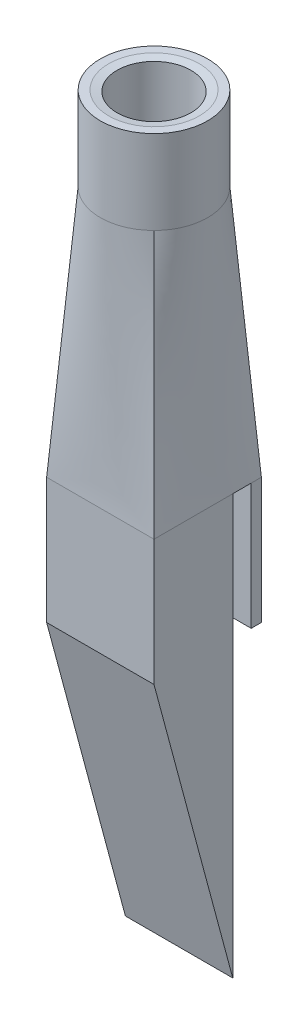
from build123d import *

# Parameters (mm, degrees)
SKETCH1_R                       = 6.4
SKETCH1_R_2                     = 4.4
BOSS_EXTRUDE1_DEPTH             = 10
CHAMFER1_SIZE                   = 1
CHAMFER1_SIZE2                  = 0.176326981
BOSS_EXTRUDE2_START             = -30
SKETCH4_W                       = 12.8
SKETCH4_H                       = 9.39
SKETCH4_H_2                     = 1.21
BOSS_EXTRUDE2_DEPTH             = 15
BOSS_EXTRUDE3_REACH             = 47.901
BOSS_EXTRUDE3_DIRECTION_2_REACH = 47.901


with BuildPart() as part:
    # Sketch1 → Boss-Extrude1 (new body)
    with BuildSketch(Plane(origin=(0, 0, 0), x_dir=(1, 0, 0), z_dir=(0, 1, 0))):
        with Locations(Location((0, 0, 0), (0, 0, 270))):
            Circle(SKETCH1_R)
        with Locations(Location((0, 0, 0), (0, 0, 270))):
            Circle(SKETCH1_R_2, mode=Mode.SUBTRACT)
    extrude(amount=BOSS_EXTRUDE1_DEPTH)

    # Chamfer1
    chamfer1_edges = [part.edges().sort_by_distance(p)[0] for p in [
        (0, 10, -4.4),
    ]]
    chamfer1_side = [part.faces().sort_by_distance(p)[0] for p in [
        (0, 10, -6.218980664),
    ]]
    chamfer(chamfer1_edges, length=CHAMFER1_SIZE, length2=CHAMFER1_SIZE2, reference=chamfer1_side[0])

    # Sketch2 for Loft1 → Loft1 section 0
    with BuildSketch(Plane.XZ):
        with BuildLine():
            # circular arc as an exact rational Bezier (weights 1, cos(half-angle), 1)
            Bezier((-4.5254834, -4.5254834), (0, -9.050966798), (4.5254834, -4.5254834), weights=[1, 0.707106781, 1])
            Bezier((4.5254834, -4.5254834), (9.050966798, 0), (4.5254834, 4.5254834), weights=[1, 0.707106781, 1])
            Bezier((4.5254834, 4.5254834), (0, 9.050966798), (-4.5254834, 4.5254834), weights=[1, 0.707106781, 1])
            Bezier((-4.5254834, 4.5254834), (-9.050966798, 0), (-4.5254834, -4.5254834), weights=[1, 0.707106781, 1])
        make_face()
    # Sketch3 → Loft1 section 1
    with BuildSketch(Plane(origin=(0, -30, 0), x_dir=(-1, 0, 0), z_dir=(0, -1, 0))):
        with BuildLine():
            Line((6.4, 6.4), (-6.4, 6.4))
            Line((-6.4, 6.4), (-6.4, -6.4))
            Line((-6.4, -6.4), (6.4, -6.4))
            Line((6.4, -6.4), (6.4, 6.4))
        make_face()
    loft()

    # Sketch4 → Boss-Extrude2 (add)
    with BuildSketch(Plane(origin=(0, 0, 0), x_dir=(1, 0, 0), z_dir=(0, 1, 0)).offset(BOSS_EXTRUDE2_START)):
        with Locations((0, -1.705)):
            Rectangle(SKETCH4_W, SKETCH4_H)
        with Locations((0, 5.795)):
            Rectangle(SKETCH4_W, SKETCH4_H_2)
    extrude(amount=-BOSS_EXTRUDE2_DEPTH)

    # Boss-Extrude3: up to this face of the body (flat: up to its plane)
    boss_extrude3_end = Plane(part.part.faces().sort_by_distance((6.4, -37.5, 1.705))[0])
    # Sketch5 → Boss-Extrude3 (add, up to the picked face)
    with BuildSketch(Plane(origin=(0, 0, 0), x_dir=(0, 0, -1), z_dir=(1, 0, 0)), mode=Mode.PRIVATE) as boss_extrude3_sk1:
        Polygon((2.99, -45), (2.99, -80), (-6.4, -45), align=None)
    boss_extrude3_tool1 = split(extrude(boss_extrude3_sk1.sketch, amount=BOSS_EXTRUDE3_REACH, mode=Mode.PRIVATE), bisect_by=boss_extrude3_end, keep=Keep.BOTH, mode=Mode.PRIVATE)
    add(boss_extrude3_tool1.solids().sort_by(Axis((0, -56.666667, 0.14), (1, 0, 0)))[0])

    # Boss-Extrude3 direction 2: up to this face of the body (flat: up to its plane)
    boss_extrude3_direction_2_end = Plane(part.part.faces().sort_by_distance((-6.4, -37.5, 1.705))[0])
    # Sketch5 → Boss-Extrude3 direction 2 (add, up to the picked face)
    with BuildSketch(Plane(origin=(0, 0, 0), x_dir=(0, 0, -1), z_dir=(1, 0, 0)), mode=Mode.PRIVATE) as boss_extrude3_direction_2_sk1:
        Polygon((2.99, -45), (2.99, -80), (-6.4, -45), align=None)
    boss_extrude3_direction_2_tool1 = split(extrude(boss_extrude3_direction_2_sk1.sketch, amount=-BOSS_EXTRUDE3_DIRECTION_2_REACH, mode=Mode.PRIVATE), bisect_by=boss_extrude3_direction_2_end, keep=Keep.BOTH, mode=Mode.PRIVATE)
    add(boss_extrude3_direction_2_tool1.solids().sort_by(Axis((0, -56.666667, 0.14), (-1, 0, 0)))[0])


solid = part.part
